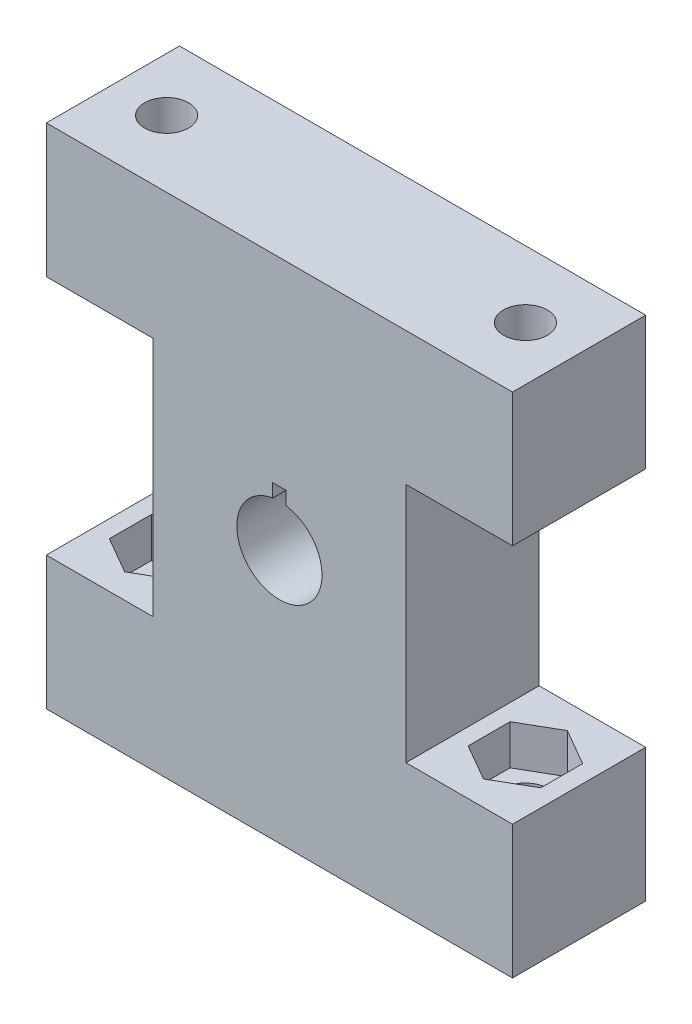
from build123d import *

# Parameters (mm, degrees)
SKETCH1_W                                  = 35
SKETCH1_H                                  = 38.1
BOSS_EXTRUDE1_DEPTH                        = 10
F_3_3_3_3_DIAMETER_HOLE1_D                 = 3.3
SKETCH4_R                                  = 3.2
CUT_EXTRUDE1_DEPTH                         = 28.733598757
SKETCH5_W                                  = 8
SKETCH5_H                                  = 9.05
CUT_EXTRUDE2_DEPTH                         = 10
CUT_EXTRUDE3_DEPTH                         = 3
MIRROR2_AT_THE_SECOND_PLANE_COPY_1_SKETC_W = 8
MIRROR2_AT_THE_SECOND_PLANE_COPY_1_SKETC_H = 9.05
MIRROR2_AT_THE_SECOND_PLANE_COPY_1_DEPTH   = 10
MIRROR2_AT_THE_SECOND_PLANE_COPY_2_DEPTH   = 3
CUT_EXTRUDE4_DEPTH                         = 28.733598757
CUT_EXTRUDE4_DEPTH_BACK                    = 28.733598757
SKETCH7_W                                  = 1
SKETCH7_H                                  = 1


with BuildPart() as part:
    # Sketch1 → Boss-Extrude1 (new body)
    with BuildSketch(Plane.XY):
        Rectangle(SKETCH1_W, SKETCH1_H)
    extrude(amount=BOSS_EXTRUDE1_DEPTH)

    # Ø3.3 (3.3) Diameter Hole1 (through all)
    with Locations(Plane(origin=(0, 19.05, 0), x_dir=(1, 0, 0), z_dir=(0, 1, 0))):
        with Locations((-13.47, -5), (13.47, -5)):
            Hole(F_3_3_3_3_DIAMETER_HOLE1_D / 2)

    # Sketch4 → Cut-Extrude1 (cut, through all)
    with BuildSketch(Plane.XY.offset(10)):
        Circle(SKETCH4_R)
    extrude(amount=-CUT_EXTRUDE1_DEPTH, mode=Mode.SUBTRACT)

    # Sketch5 → Cut-Extrude2 (cut)
    with BuildSketch(Plane(origin=(0, 0, 0), x_dir=(-1, 0, 0), z_dir=(0, 0, -1))):
        with Locations((-13.5, 4.525)):
            Rectangle(SKETCH5_W, SKETCH5_H)
    cut_extrude2 = extrude(amount=-CUT_EXTRUDE2_DEPTH, mode=Mode.SUBTRACT)

    # Sketch6 → Cut-Extrude3 (cut)
    with BuildSketch(Plane.XZ.offset(-9.05)):
        Polygon((16.195, 6.573279484), (13.47, 8.146558967), (10.745, 6.573279484), (10.745, 3.426720516), (13.47, 1.853441033), (16.195, 3.426720516), align=None)
    cut_extrude3 = extrude(amount=-CUT_EXTRUDE3_DEPTH, mode=Mode.SUBTRACT)

    # Mirror2: Cut-Extrude2, Cut-Extrude3 across plane
    add(cut_extrude2.mirror(Plane(origin=(0, 0, 0), x_dir=(0, 0, 1), z_dir=(1, 0, 0))), mode=Mode.SUBTRACT)
    add(cut_extrude3.mirror(Plane(origin=(0, 0, 0), x_dir=(0, 0, 1), z_dir=(1, 0, 0))), mode=Mode.SUBTRACT)

    # Mirror2 at the second plane: Cut-Extrude2, Cut-Extrude3 across plane
    add(cut_extrude2.mirror(Plane.ZX), mode=Mode.SUBTRACT)
    add(cut_extrude3.mirror(Plane.ZX), mode=Mode.SUBTRACT)

    # Mirror2 at the second plane copy 1 sketc → Mirror2 at the second plane copy 1 (cut)
    with BuildSketch(Plane(origin=(0, 0, 0), x_dir=(1, 0, 0), z_dir=(0, 0, -1))):
        with Locations((-13.5, 4.525)):
            Rectangle(MIRROR2_AT_THE_SECOND_PLANE_COPY_1_SKETC_W, MIRROR2_AT_THE_SECOND_PLANE_COPY_1_SKETC_H)
    extrude(amount=-MIRROR2_AT_THE_SECOND_PLANE_COPY_1_DEPTH, mode=Mode.SUBTRACT)

    # Mirror2 at the second plane copy 2 sketc → Mirror2 at the second plane copy 2 (cut)
    with BuildSketch(Plane(origin=(0, -9.05, 0), x_dir=(-1, 0, 0), z_dir=(0, 1, 0))):
        Polygon((16.195, 6.573279484), (13.47, 8.146558967), (10.745, 6.573279484), (10.745, 3.426720516), (13.47, 1.853441033), (16.195, 3.426720516), align=None)
    extrude(amount=-MIRROR2_AT_THE_SECOND_PLANE_COPY_2_DEPTH, mode=Mode.SUBTRACT)

    # Sketch7 → Cut-Extrude4 (cut, two sides: drawn at the far end of the back side and taken through both)
    with BuildSketch(Plane.XY.offset(10).offset(-CUT_EXTRUDE4_DEPTH_BACK)):
        with Locations((0, 3.660696126)):
            Rectangle(SKETCH7_W, SKETCH7_H)
    extrude(amount=CUT_EXTRUDE4_DEPTH + CUT_EXTRUDE4_DEPTH_BACK, mode=Mode.SUBTRACT)


solid = part.part
